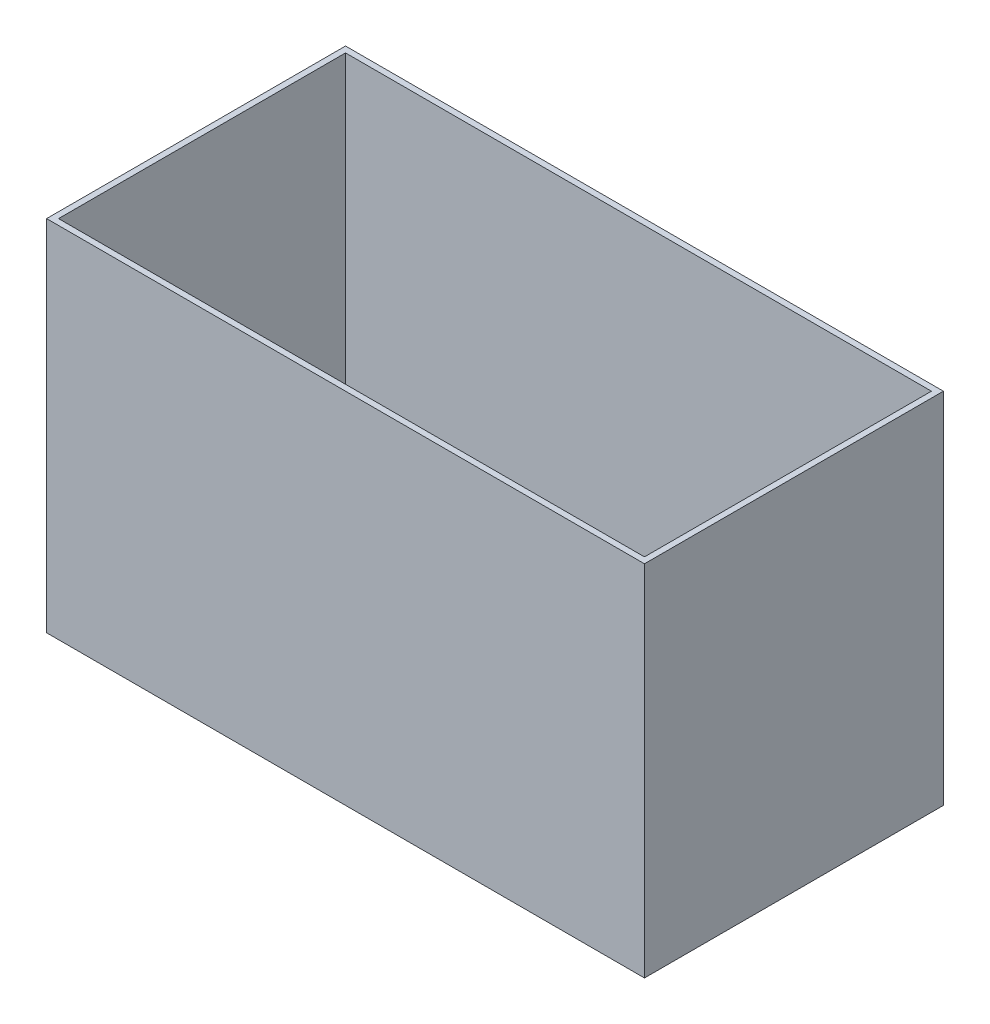
from build123d import *

# Parameters (mm, degrees)
SKETCH1_W           = 500
SKETCH1_H           = 250
BOSS_EXTRUDE1_DEPTH = 300
SHELL1_T            = -5


with BuildPart() as part:
    # Sketch1 → Boss-Extrude1 (new body)
    with BuildSketch(Plane(origin=(0, 0, 0), x_dir=(1, 0, 0), z_dir=(0, 1, 0))):
        with Locations((250, 125)):
            Rectangle(SKETCH1_W, SKETCH1_H)
    extrude(amount=BOSS_EXTRUDE1_DEPTH)

    # Shell1
    shell1_openings = [part.faces().sort_by_distance(p)[0] for p in [
        (250, 300, -125),
    ]]
    offset(amount=SHELL1_T, openings=shell1_openings, kind=Kind.INTERSECTION)


solid = part.part
